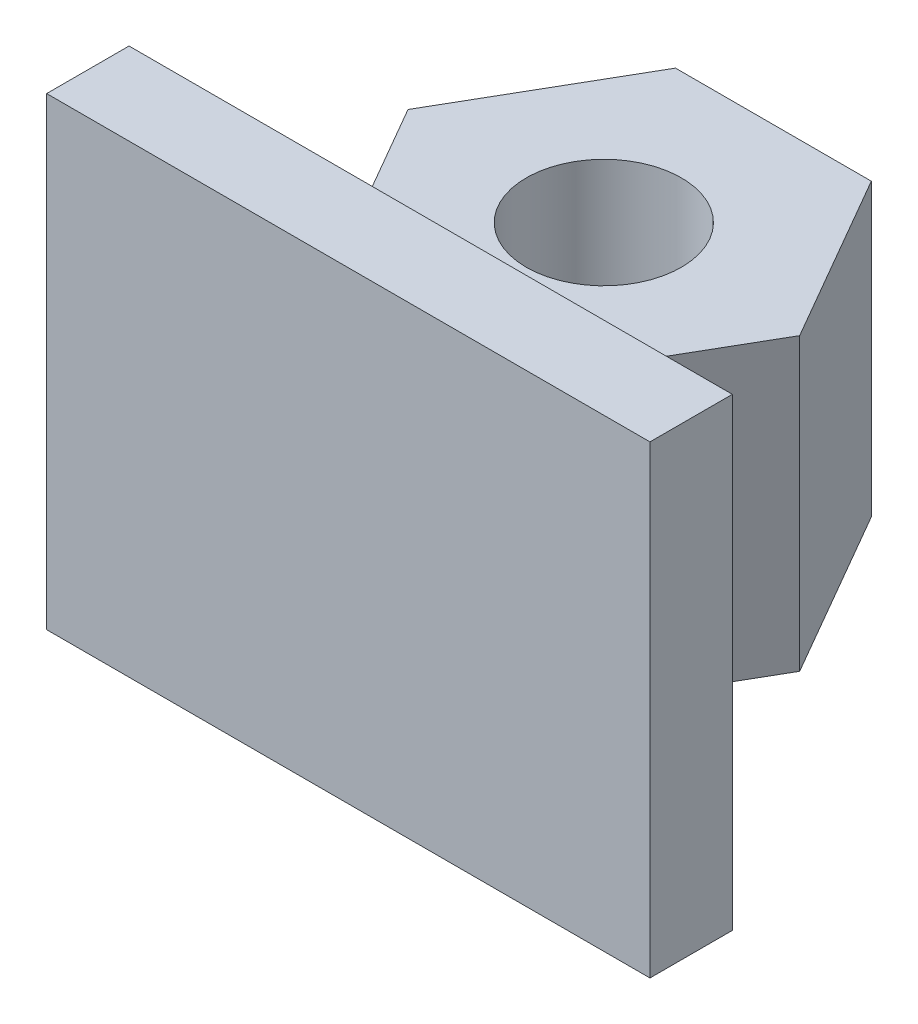
from build123d import *

# Parameters (mm, degrees)
CROQUIS1_R              = 8
SALIENTE_EXTRUIR1_DEPTH = 30
CROQUIS2_W              = 62.253703669
CROQUIS2_H              = 47.910213751
SALIENTE_EXTRUIR2_DEPTH = 8.5


with BuildPart() as part:
    # Croquis1 → Saliente-Extruir1 (new body)
    with BuildSketch(Plane(origin=(0, 0, 0), x_dir=(1, 0, 0), z_dir=(0, 1, 0))):
        Polygon((20.207259422, 0), (10.103629711, 17.5), (-10.103629711, 17.5), (-20.207259422, 0), (-10.103629711, -17.5), (10.103629711, -17.5), align=None)
        with Locations(Location((0, 0, 0), (0, 0, 270))):
            Circle(CROQUIS1_R, mode=Mode.SUBTRACT)
    extrude(amount=SALIENTE_EXTRUIR1_DEPTH)

    # Croquis2 → Saliente-Extruir2 (add)
    with BuildSketch(Plane.XY.offset(17.5)):
        with Locations((-0.366655868, 14.825803959)):
            Rectangle(CROQUIS2_W, CROQUIS2_H)
    extrude(amount=SALIENTE_EXTRUIR2_DEPTH)


solid = part.part
